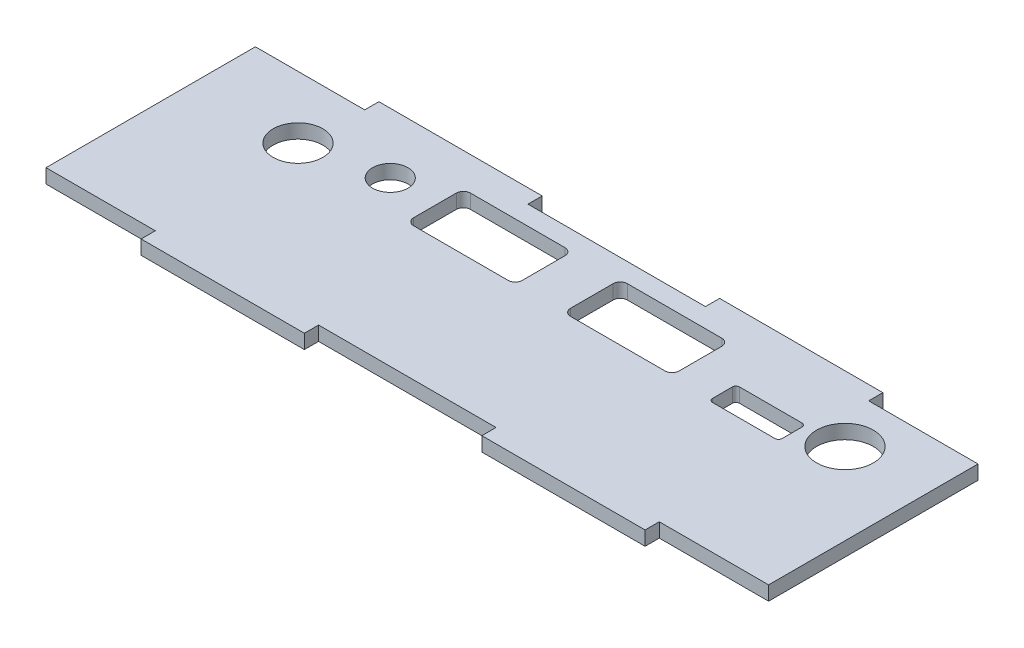
from build123d import *

# Parameters (mm, degrees)
SKETCH_1_W                     = 101.8
SKETCH_1_H                     = 29.5
EXTRUDE_1_DEPTH                = 2
SKETCH_2_W                     = 23
SKETCH_2_H                     = 2
EXTRUDE_2_DEPTH                = 2
SKETCH_3_R                     = 4
CUT_EXTRUDE_1_DEPTH            = 54.622499942
SKETCH_4_R                     = 3.5
CUT_EXTRUDE_2_DEPTH            = 54.622499942
SKETCH_5_R                     = 2.5
CUT_EXTRUDE_3_DEPTH            = 54.622499942
SKETCH_6_W                     = 15.3
SKETCH_6_H                     = 8
CUT_EXTRUDE_4_DEPTH            = 54.622499942
FILLET_1_R                     = 1
PATTERN_LINEAR_1_COUNT         = 2
PATTERN_LINEAR_1_PITCH         = 22.1
FILLET_1_OF_PATTERN_LINEAR_1_R = 1
SKETCH_7_W                     = 9.8
SKETCH_7_H                     = 3.8
CUT_EXTRUDE_5_DEPTH            = 54.622499942
FILLET_2_R                     = 0.5


with BuildPart() as part:
    # 草图1 → 凸台-拉伸1 (new body)
    with BuildSketch(Plane(origin=(0, 0, 0), x_dir=(1, 0, 0), z_dir=(0, 1, 0))):
        Rectangle(SKETCH_1_W, SKETCH_1_H)
    extrude(amount=EXTRUDE_1_DEPTH)

    # 草图2 → 凸台-拉伸2 (add)
    with BuildSketch(Plane(origin=(0, 2, 0), x_dir=(1, 0, 0), z_dir=(0, 1, 0))):
        with Locations((-24, 15.75)):
            Rectangle(SKETCH_2_W, SKETCH_2_H)
        with Locations((24, 15.75)):
            Rectangle(SKETCH_2_W, SKETCH_2_H)
        with Locations((24, -15.75)):
            Rectangle(SKETCH_2_W, SKETCH_2_H)
        with Locations((-24, -15.75)):
            Rectangle(SKETCH_2_W, SKETCH_2_H)
    extrude(amount=-EXTRUDE_2_DEPTH)

    # 草图3 → 切除-拉伸1 (cut, through all)
    with BuildSketch(Plane(origin=(0, 2, 0), x_dir=(1, 0, 0), z_dir=(0, 1, 0))):
        with Locations(Location((39.4, 7.51, 0), (0, 0, 270))):
            Circle(SKETCH_3_R)
    extrude(amount=-CUT_EXTRUDE_1_DEPTH, mode=Mode.SUBTRACT)

    # 草图4 → 切除-拉伸2 (cut, through all)
    with BuildSketch(Plane(origin=(0, 2, 0), x_dir=(1, 0, 0), z_dir=(0, 1, 0))):
        with Locations(Location((-36.15, 6, 0), (0, 0, 270))):
            Circle(SKETCH_4_R)
    extrude(amount=-CUT_EXTRUDE_2_DEPTH, mode=Mode.SUBTRACT)

    # 草图5 → 切除-拉伸3 (cut, through all)
    with BuildSketch(Plane(origin=(0, 2, 0), x_dir=(1, 0, 0), z_dir=(0, 1, 0))):
        with Locations(Location((-25.4, 8.25, 0), (0, 0, 270))):
            Circle(SKETCH_5_R)
    extrude(amount=-CUT_EXTRUDE_3_DEPTH, mode=Mode.SUBTRACT)

    # 草图6 → 切除-拉伸4 (cut, through all)
    with BuildSketch(Plane(origin=(0, 2, 0), x_dir=(1, 0, 0), z_dir=(0, 1, 0))):
        with Locations((-11.25, 8.05)):
            Rectangle(SKETCH_6_W, SKETCH_6_H)
    cut_extrude_4 = extrude(amount=-CUT_EXTRUDE_4_DEPTH, mode=Mode.SUBTRACT)

    # 圆角1
    fillet_1_edges = [part.edges().sort_by_distance(p)[0] for p in [
        (-18.9, 1, -4.05),
        (-18.9, 1, -12.05),
        (-3.6, 1, -12.05),
        (-3.6, 1, -4.05),
    ]]
    fillet(fillet_1_edges, radius=FILLET_1_R)

    # 阵列(线性)1: 切除-拉伸4 ×2
    with Locations(*[(i * PATTERN_LINEAR_1_PITCH, 0, 0) for i in range(1, PATTERN_LINEAR_1_COUNT)]):
        add(cut_extrude_4, mode=Mode.SUBTRACT)

    # 圆角1 of 阵列(线性)1
    fillet_1_of_pattern_linear_1_edges = [part.edges().sort_by_distance(p)[0] for p in [
        (3.2, 1, -4.05),
        (3.2, 1, -12.05),
        (18.5, 1, -12.05),
        (18.5, 1, -4.05),
    ]]
    fillet(fillet_1_of_pattern_linear_1_edges, radius=FILLET_1_OF_PATTERN_LINEAR_1_R)

    # 草图7 → 切除-拉伸5 (cut, through all)
    with BuildSketch(Plane(origin=(0, 2, 0), x_dir=(1, 0, 0), z_dir=(0, 1, 0))):
        with Locations((29.1, 5.45)):
            Rectangle(SKETCH_7_W, SKETCH_7_H)
    extrude(amount=-CUT_EXTRUDE_5_DEPTH, mode=Mode.SUBTRACT)

    # 圆角2
    fillet_2_edges = [part.edges().sort_by_distance(p)[0] for p in [
        (24.2, 1, -3.55),
        (24.2, 1, -7.35),
        (34, 1, -7.35),
        (34, 1, -3.55),
    ]]
    fillet(fillet_2_edges, radius=FILLET_2_R)


solid = part.part
